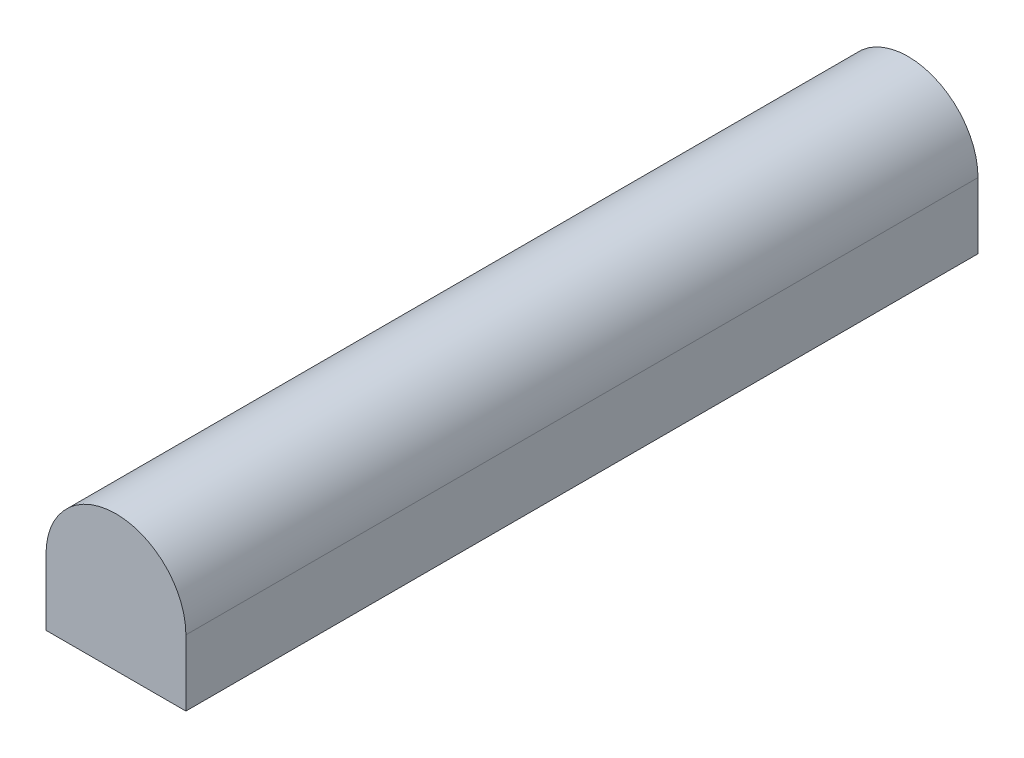
from build123d import *

# Parameters (mm, degrees)
EXTRUDE_THIN1_DEPTH = 18288
BOSS_EXTRUDE5_DEPTH = 0.00254
BOSS_EXTRUDE6_DEPTH = 0.00254


with BuildPart() as part:
    # Sketch1 → Extrude-Thin1 (new body)
    with BuildSketch(Plane.XY):
        with BuildLine():
            Line((1614.9701, -1524), (1614.9701, 0))
            ThreePointArc((1614.9701, 0), (0, 1614.9701), (-1614.9701, 0))
            Line((-1614.9701, 0), (-1614.9701, -1524))
            Line((-1614.9701, -1524), (-1614.96756, -1524))
            Line((-1614.96756, -1524), (-1614.96756, 0))
            ThreePointArc((-1614.96756, 0), (0, 1614.96756), (1614.96756, 0))
            Line((1614.96756, 0), (1614.96756, -1524))
            Line((1614.96756, -1524), (1614.9701, -1524))
        make_face()
    extrude(amount=-EXTRUDE_THIN1_DEPTH)

    # Sketch2 → Boss-Extrude5 (add)
    with BuildSketch(Plane.XY):
        with BuildLine():
            Line((-1614.96756, 0), (-1614.96756, -1524))
            Line((-1614.96756, -1524), (1614.9701, -1524))
            Line((1614.9701, -1524), (1614.9701, 0))
            ThreePointArc((1614.9701, 0), (0.00127, 1614.96883), (-1614.96756, 0))
        make_face()
    extrude(amount=-BOSS_EXTRUDE5_DEPTH)


with BuildPart() as body_2:
    # Sketch3 → Boss-Extrude6 (new body)
    with BuildSketch(Plane(origin=(0, 0, -18288), x_dir=(-1, 0, 0), z_dir=(0, 0, -1))):
        with BuildLine():
            Line((-1614.96756, 0), (-1614.96756, -1524))
            Line((-1614.96756, -1524), (1614.96756, -1524))
            Line((1614.96756, -1524), (1614.96756, 0))
            ThreePointArc((1614.96756, 0), (0, 1614.96756), (-1614.96756, 0))
        make_face()
    extrude(amount=BOSS_EXTRUDE6_DEPTH)


solid = Compound([part.part, body_2.part])
